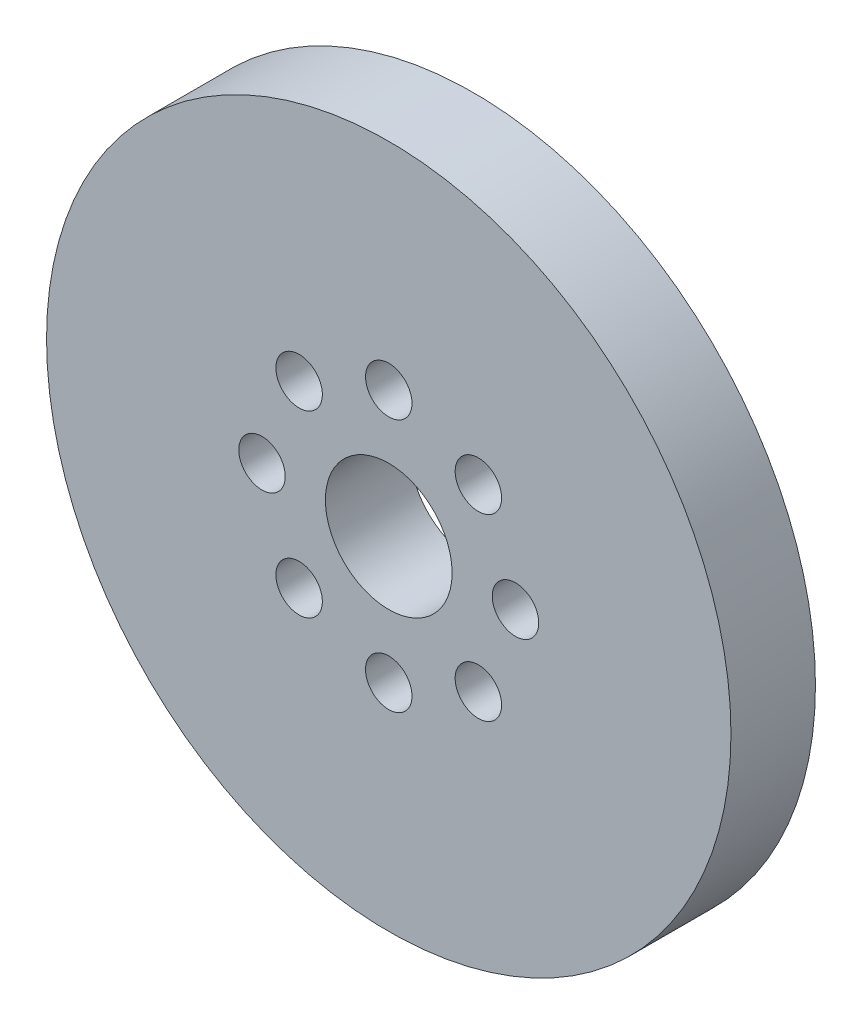
from build123d import *

# Parameters (mm, degrees)
SKETCH1_R         = 40.5
SKETCH1_R_2       = 7.5
EXTRUDE_1_4_DEPTH = 10
SKETCH2_R         = 2.75
M5_THROUGH_DEPTH  = 10
CIRPATTERN5_COUNT = 8


with BuildPart() as part:
    # Sketch1 → 1/4 (new body)
    with BuildSketch(Plane.XY):
        Circle(SKETCH1_R)
        Circle(SKETCH1_R_2, mode=Mode.SUBTRACT)
    extrude(amount=EXTRUDE_1_4_DEPTH)

    # Sketch2 → M5_through (cut)
    with BuildSketch(Plane.XY):
        with Locations((0, 15)):
            Circle(SKETCH2_R)
    m5_through = extrude(amount=M5_THROUGH_DEPTH, mode=Mode.SUBTRACT)

    # CirPattern5: M5_through ×8 about axis
    cirpattern5_axis = Axis((0, 0, 0), (0, 0, 1))
    for i in range(1, CIRPATTERN5_COUNT):
        add(m5_through.rotate(cirpattern5_axis, i * 360 / CIRPATTERN5_COUNT), mode=Mode.SUBTRACT)


solid = part.part
